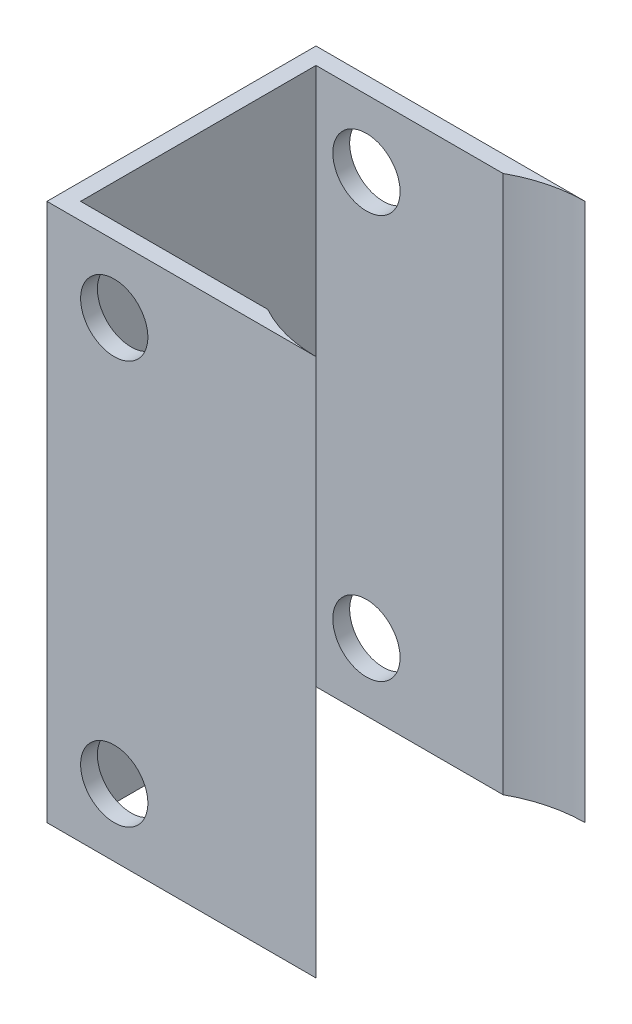
from build123d import *

# Parameters (mm, degrees)
SKETCH1_W           = 25.4
SKETCH1_H           = 25.4
SKETCH1_W_2         = 22.225
SKETCH1_H_2         = 22.225
BOSS_EXTRUDE1_DEPTH = 50.8
SKETCH2_R           = 12.7
CUT_EXTRUDE1_DEPTH  = 54.881536726
SKETCH3_R           = 3.175
CUT_EXTRUDE2_DEPTH  = 59.198711326


with BuildPart() as part:
    # Sketch1 → Boss-Extrude1 (new body)
    with BuildSketch(Plane(origin=(0, 0, 0), x_dir=(1, 0, 0), z_dir=(0, 1, 0))):
        Rectangle(SKETCH1_W, SKETCH1_H)
        Rectangle(SKETCH1_W_2, SKETCH1_H_2, mode=Mode.SUBTRACT)
    extrude(amount=BOSS_EXTRUDE1_DEPTH)

    # Sketch2 → Cut-Extrude1 (cut, through all)
    with BuildSketch(Plane(origin=(0, 50.8, 0), x_dir=(1, 0, 0), z_dir=(0, 1, 0))):
        with Locations((12.7, 0)):
            Circle(SKETCH2_R)
    extrude(amount=-CUT_EXTRUDE1_DEPTH, mode=Mode.SUBTRACT)

    # Sketch3 → Cut-Extrude2 (cut, through all)
    with BuildSketch(Plane(origin=(0, 0, -12.7), x_dir=(-1, 0, 0), z_dir=(0, 0, -1))):
        with Locations((6.35, 44.45)):
            Circle(SKETCH3_R)
        with Locations((6.35, 6.35)):
            Circle(SKETCH3_R)
    extrude(amount=-CUT_EXTRUDE2_DEPTH, mode=Mode.SUBTRACT)


solid = part.part
